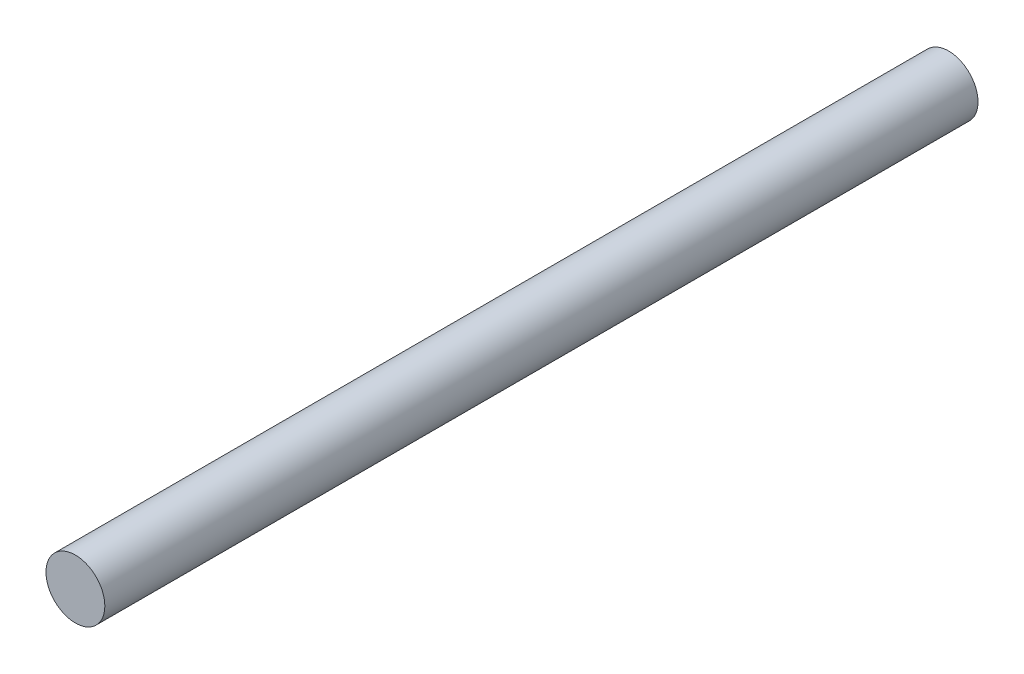
from build123d import *

# Parameters (mm, degrees)
SKETCH_1_R      = 10
EXTRUDE_1_DEPTH = 296.5


with BuildPart() as part:
    # 草图1 → 凸台-拉伸1 (new body)
    with BuildSketch(Plane.XY):
        Circle(SKETCH_1_R)
    extrude(amount=EXTRUDE_1_DEPTH)


solid = part.part
